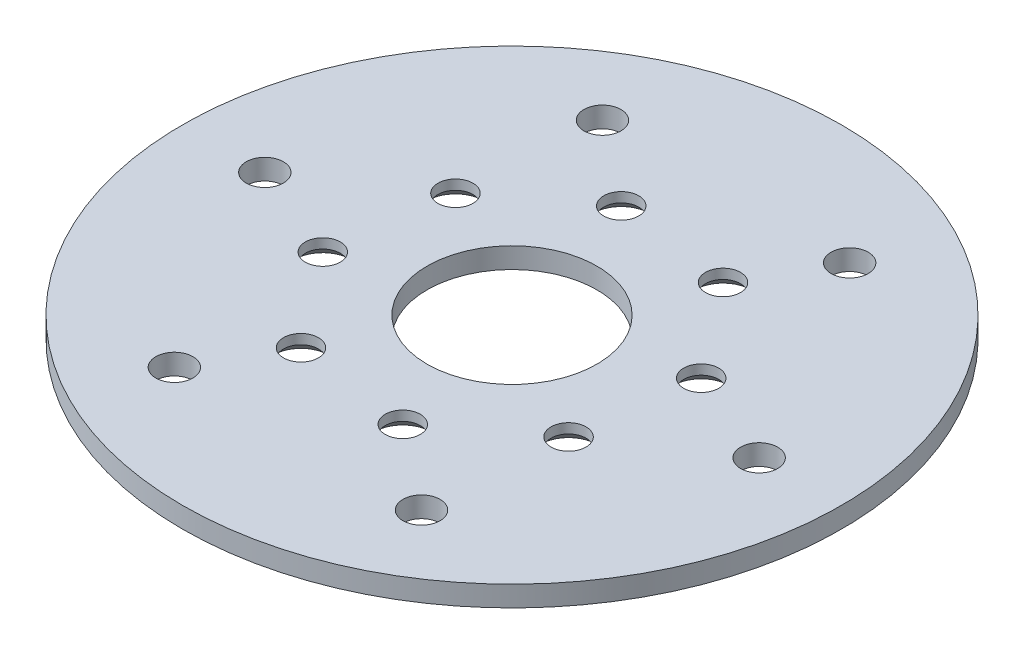
from build123d import *

# Parameters (mm, degrees)
SKETCH1_R                                    = 32
SKETCH1_R_2                                  = 8.25
BOSS_EXTRUDE1_DEPTH                          = 2
CSK_FOR_M3_HEX_SOCKET_COUNTERSUNK_HE_2_COUNT = 2
CSK_FOR_M3_HEX_SOCKET_COUNTERSUNK_HE_2_PITCH = 11.480502971
CSK_FOR_M3_HEX_SOCKET_COUNTERSUNK_HE_3_COUNT = 2
CSK_FOR_M3_HEX_SOCKET_COUNTERSUNK_HE_3_PITCH = 21.213203436
CSK_FOR_M3_HEX_SOCKET_COUNTERSUNK_HE_4_COUNT = 2
CSK_FOR_M3_HEX_SOCKET_COUNTERSUNK_HE_4_PITCH = 27.716385975
CSK_FOR_M3_HEX_SOCKET_COUNTERSUNK_HE_5_COUNT = 2
CSK_FOR_M3_HEX_SOCKET_COUNTERSUNK_HE_5_PITCH = 30
CSK_FOR_M3_HEX_SOCKET_COUNTERSUNK_HE_6_COUNT = 2
CSK_FOR_M3_HEX_SOCKET_COUNTERSUNK_HE_6_PITCH = 27.716385975
CSK_FOR_M3_HEX_SOCKET_COUNTERSUNK_HE_7_COUNT = 2
CSK_FOR_M3_HEX_SOCKET_COUNTERSUNK_HE_7_PITCH = 21.213203436
CSK_FOR_M3_HEX_SOCKET_COUNTERSUNK_HE_8_COUNT = 2
CSK_FOR_M3_HEX_SOCKET_COUNTERSUNK_HE_8_PITCH = 11.480502971
M3_CLEARANCE_HOLE1_D                         = 3.6


with BuildPart() as part:
    # Sketch1 → Boss-Extrude1 (new body)
    with BuildSketch(Plane(origin=(0, 0, 0), x_dir=(1, 0, 0), z_dir=(0, 1, 0))):
        with Locations(Location((0, 0, 0), (0, 0, 270))):
            Circle(SKETCH1_R)
        with Locations(Location((0, 0, 0), (0, 0, 270))):
            Circle(SKETCH1_R_2, mode=Mode.SUBTRACT)
    extrude(amount=BOSS_EXTRUDE1_DEPTH)

    # Sketch4 → CSK for M3 Hex Socket Countersunk Head Screw1 (revolve, cut)
    with BuildSketch(Plane(origin=(-3.882285677, 0, -14.488887394), x_dir=(0, 0, -1), z_dir=(1, 0, 0))):
        Polygon((0, 0), (0, 2), (1.7, 2), (1.7, 1.05), (2.75, 0), align=None)
    csk_for_m3_hex_socket_countersunk_head_s = revolve(axis=Axis((-3.882285677, -6.35, -14.488887394), (0, 1, 0)), mode=Mode.SUBTRACT)

    # CSK for M3 Hex Socket Countersunk He 2: CSK for M3 Hex Socket Countersunk Head Screw1 ×2
    with Locations(*[Vector(0.9914448613738199, 0, 0.1305261922199794) * (i * CSK_FOR_M3_HEX_SOCKET_COUNTERSUNK_HE_2_PITCH) for i in range(1, CSK_FOR_M3_HEX_SOCKET_COUNTERSUNK_HE_2_COUNT)]):
        add(csk_for_m3_hex_socket_countersunk_head_s, mode=Mode.SUBTRACT)

    # CSK for M3 Hex Socket Countersunk He 3: CSK for M3 Hex Socket Countersunk Head Screw1 ×2
    with Locations(*[Vector(0.8660254037844777, 0, 0.49999999999993255) * (i * CSK_FOR_M3_HEX_SOCKET_COUNTERSUNK_HE_3_PITCH) for i in range(1, CSK_FOR_M3_HEX_SOCKET_COUNTERSUNK_HE_3_COUNT)]):
        add(csk_for_m3_hex_socket_countersunk_head_s, mode=Mode.SUBTRACT)

    # CSK for M3 Hex Socket Countersunk He 4: CSK for M3 Hex Socket Countersunk Head Screw1 ×2
    with Locations(*[Vector(0.608761429008784, 0, 0.7933533402911866) * (i * CSK_FOR_M3_HEX_SOCKET_COUNTERSUNK_HE_4_PITCH) for i in range(1, CSK_FOR_M3_HEX_SOCKET_COUNTERSUNK_HE_4_COUNT)]):
        add(csk_for_m3_hex_socket_countersunk_head_s, mode=Mode.SUBTRACT)

    # CSK for M3 Hex Socket Countersunk He 5: CSK for M3 Hex Socket Countersunk Head Screw1 ×2
    with Locations(*[Vector(0.2588190451025913, 0, 0.9659258262890494) * (i * CSK_FOR_M3_HEX_SOCKET_COUNTERSUNK_HE_5_PITCH) for i in range(1, CSK_FOR_M3_HEX_SOCKET_COUNTERSUNK_HE_5_COUNT)]):
        add(csk_for_m3_hex_socket_countersunk_head_s, mode=Mode.SUBTRACT)

    # CSK for M3 Hex Socket Countersunk He 6: CSK for M3 Hex Socket Countersunk Head Screw1 ×2
    with Locations(*[Vector(-0.13052619221997924, 0, 0.99144486137382) * (i * CSK_FOR_M3_HEX_SOCKET_COUNTERSUNK_HE_6_PITCH) for i in range(1, CSK_FOR_M3_HEX_SOCKET_COUNTERSUNK_HE_6_COUNT)]):
        add(csk_for_m3_hex_socket_countersunk_head_s, mode=Mode.SUBTRACT)

    # CSK for M3 Hex Socket Countersunk He 7: CSK for M3 Hex Socket Countersunk Head Screw1 ×2
    with Locations(*[Vector(-0.4999999999999367, 0, 0.8660254037844752) * (i * CSK_FOR_M3_HEX_SOCKET_COUNTERSUNK_HE_7_PITCH) for i in range(1, CSK_FOR_M3_HEX_SOCKET_COUNTERSUNK_HE_7_COUNT)]):
        add(csk_for_m3_hex_socket_countersunk_head_s, mode=Mode.SUBTRACT)

    # CSK for M3 Hex Socket Countersunk He 8: CSK for M3 Hex Socket Countersunk Head Screw1 ×2
    with Locations(*[Vector(-0.7933533402911906, 0, 0.6087614290087786) * (i * CSK_FOR_M3_HEX_SOCKET_COUNTERSUNK_HE_8_PITCH) for i in range(1, CSK_FOR_M3_HEX_SOCKET_COUNTERSUNK_HE_8_COUNT)]):
        add(csk_for_m3_hex_socket_countersunk_head_s, mode=Mode.SUBTRACT)

    # M3 Clearance Hole1 (through all)
    with Locations(Plane(origin=(0, 0, 0), x_dir=(-1, 0, 0), z_dir=(0, -1, 0))):
        with Locations((-12, -20.784609691), (-24, 0), (-12, 20.784609691), (12, 20.784609691), (24, 0), (12, -20.784609691)):
            Hole(M3_CLEARANCE_HOLE1_D / 2)


solid = part.part
